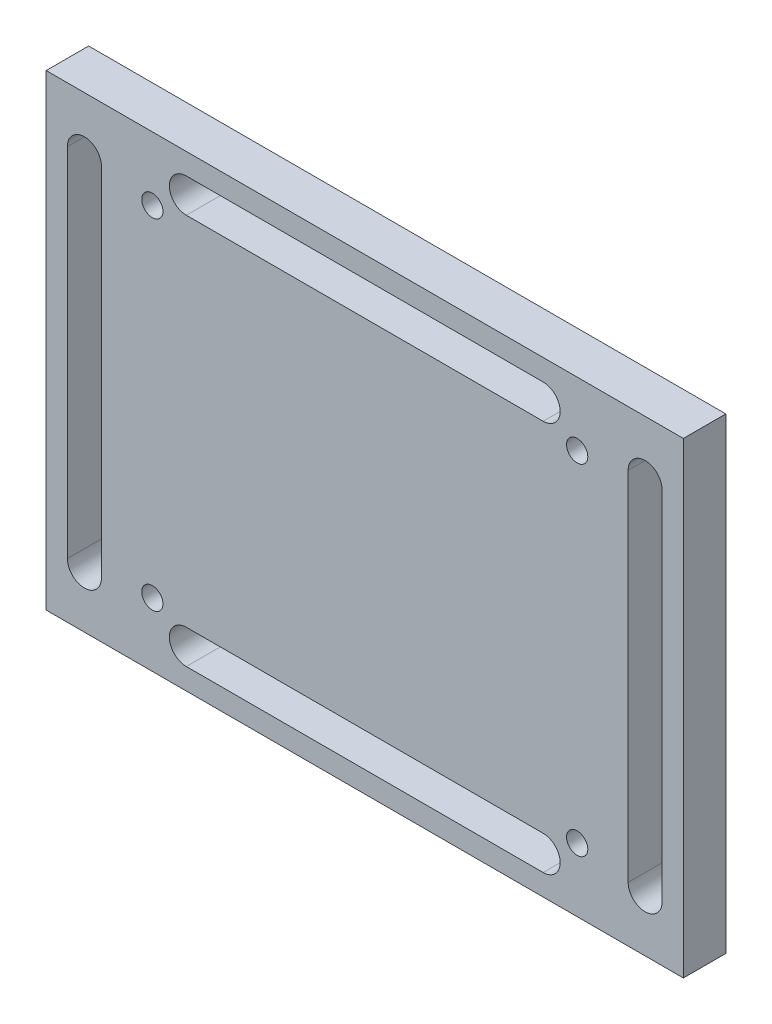
from build123d import *

# Parameters (mm, degrees)
SKETCH1_W           = 75
SKETCH1_H           = 55
SKETCH1_R           = 1.25
BOSS_EXTRUDE1_DEPTH = 5


with BuildPart() as part:
    # Sketch1 → Boss-Extrude1 (new body)
    with BuildSketch(Plane.XY):
        Rectangle(SKETCH1_W, SKETCH1_H)
        with Locations((-25, 20)):
            Circle(SKETCH1_R, mode=Mode.SUBTRACT)
        with Locations((25, 20)):
            Circle(SKETCH1_R, mode=Mode.SUBTRACT)
        with Locations((25, -20)):
            Circle(SKETCH1_R, mode=Mode.SUBTRACT)
        with Locations((-25, -20)):
            Circle(SKETCH1_R, mode=Mode.SUBTRACT)
        with BuildLine():
            Line((-21, 25), (21, 25))
            ThreePointArc((21, 25), (23, 23), (21, 21))
            Line((21, 21), (-21, 21))
            ThreePointArc((-21, 21), (-23, 23), (-21, 25))
        make_face(mode=Mode.SUBTRACT)
        with BuildLine():
            Line((-21, -25), (21, -25))
            ThreePointArc((21, -25), (23, -23), (21, -21))
            Line((21, -21), (-21, -21))
            ThreePointArc((-21, -21), (-23, -23), (-21, -25))
        make_face(mode=Mode.SUBTRACT)
        with BuildLine():
            Line((-31, 21), (-31, -21))
            ThreePointArc((-31, -21), (-33, -23), (-35, -21))
            Line((-35, -21), (-35, 21))
            ThreePointArc((-35, 21), (-33, 23), (-31, 21))
        make_face(mode=Mode.SUBTRACT)
        with BuildLine():
            Line((31, 21), (31, -21))
            ThreePointArc((31, -21), (33, -23), (35, -21))
            Line((35, -21), (35, 21))
            ThreePointArc((35, 21), (33, 23), (31, 21))
        make_face(mode=Mode.SUBTRACT)
    extrude(amount=BOSS_EXTRUDE1_DEPTH)


solid = part.part
